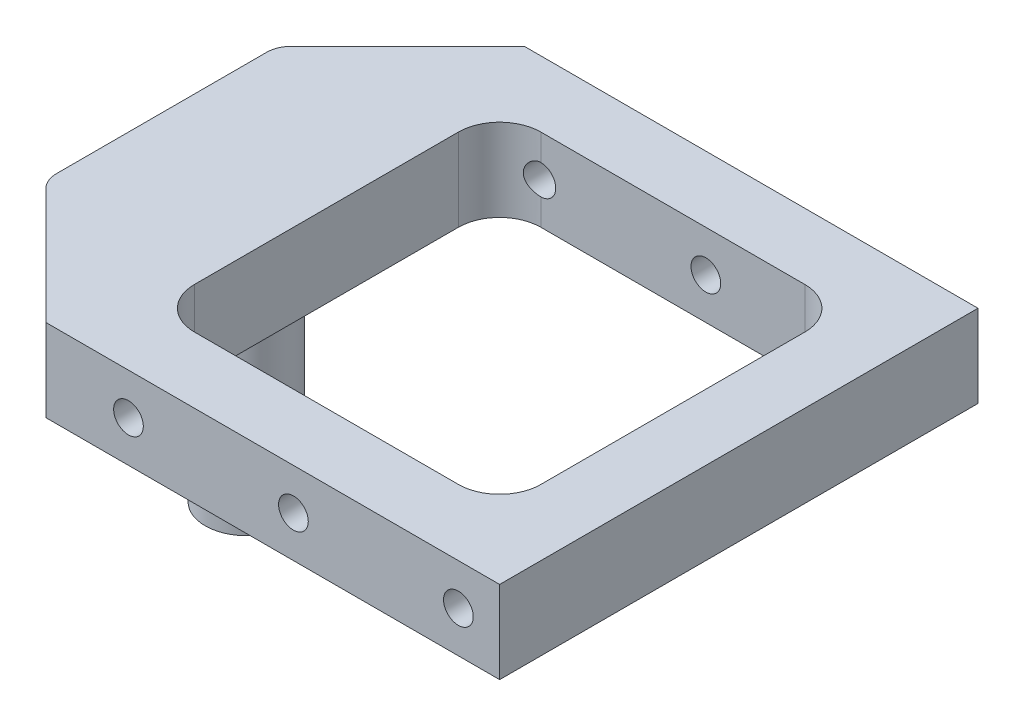
from build123d import *

# Parameters (mm, degrees)
SKETCH1_W          = 70
SKETCH1_H          = 10
EXTRUDE1_DEPTH     = 58
SKETCH2_R          = 5
EXTRUDE2_DEPTH     = 26
CUT_EXTRUDE1_DEPTH = 30
CHAMFER1_SIZE      = 15
FILLET1_R          = 3
SKETCH4_R          = 1.8
CUT_EXTRUDE2_DEPTH = 60


with BuildPart() as part:
    # Sketch1 → Extrude1 (new body)
    with BuildSketch(Plane.XY.offset(-7.106345979)):
        with Locations((-10.032216865, -100)):
            Rectangle(SKETCH1_W, SKETCH1_H)
    extrude(amount=EXTRUDE1_DEPTH)

    # Sketch2 → Extrude2 (add)
    with BuildSketch(Plane.XZ.offset(105)):
        with Locations(Location((-35.032216865, 21.593654021, 0), (0, 0, 180))):
            Circle(SKETCH2_R)
    extrude(amount=EXTRUDE2_DEPTH)

    # Sketch3 → Cut-Extrude1 (cut)
    with BuildSketch(Plane.XZ.offset(105)):
        with BuildLine():
            Line((-20.032216865, 42.893654021), (11.967783135, 42.893654021))
            ThreePointArc((11.967783135, 42.893654021), (15.503317041, 41.429187927), (16.967783135, 37.893654021))
            Line((16.967783135, 37.893654021), (16.967783135, 5.893654021))
            ThreePointArc((16.967783135, 5.893654021), (15.503317041, 2.358120115), (11.967783135, 0.893654021))
            Line((11.967783135, 0.893654021), (-20.032216865, 0.893654021))
            ThreePointArc((-20.032216865, 0.893654021), (-23.567750771, 2.358120115), (-25.032216865, 5.893654021))
            Line((-25.032216865, 5.893654021), (-25.032216865, 37.893654021))
            ThreePointArc((-25.032216865, 37.893654021), (-23.567750771, 41.429187927), (-20.032216865, 42.893654021))
        make_face()
    extrude(amount=-CUT_EXTRUDE1_DEPTH, mode=Mode.SUBTRACT)

    # Chamfer1
    chamfer1_edges = [part.edges().sort_by_distance(p)[0] for p in [
        (-45.032216865, -100, 50.893654021),
        (-45.032216865, -100, -7.106345979),
    ]]
    chamfer(chamfer1_edges, length=CHAMFER1_SIZE)

    # Fillet1
    fillet1_edges = [part.edges().sort_by_distance(p)[0] for p in [
        (-45.032216865, -100, 35.893654021),
        (-45.032216865, -100, 7.893654021),
    ]]
    fillet(fillet1_edges, radius=FILLET1_R)

    # Sketch4 → Cut-Extrude2 (cut)
    with BuildSketch(Plane.XY.offset(50.893654021)):
        with Locations((-20.032216865, -100)):
            Circle(SKETCH4_R)
        with Locations((-0.032216865, -100)):
            Circle(SKETCH4_R)
        with Locations((19.967783135, -100)):
            Circle(SKETCH4_R)
    extrude(amount=-CUT_EXTRUDE2_DEPTH, mode=Mode.SUBTRACT)


solid = part.part
